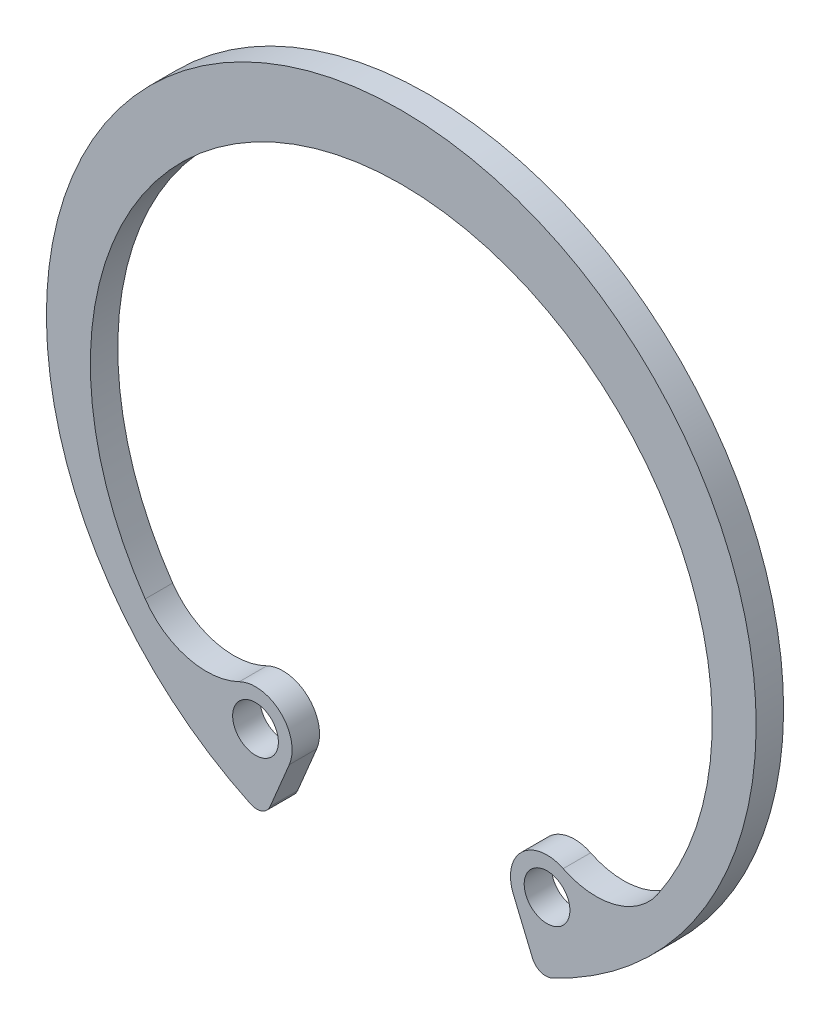
from build123d import *

# Parameters (mm, degrees)
BOSS_EXTRUDE1_DEPTH      = 0.75
BOSS_EXTRUDE1_DEPTH_BACK = 0.75
SKETCH3_R                = 1.25
FILLET1_R                = 0.79375


with BuildPart() as part:
    # Sketch3 → Boss-Extrude1 (new, two sides: drawn at the far end of the back side and taken through both)
    with BuildSketch(Plane.XY.offset(-BOSS_EXTRUDE1_DEPTH_BACK)):
        with BuildLine():
            Line((-6.123024463, -14.646111137), (-7.482857143, -17.898794624))
            ThreePointArc((-7.482857143, -17.898794624), (0, 19.4), (7.482857143, -17.898794624))
            Line((7.482857143, -17.898794624), (6.123024463, -14.646111137))
            ThreePointArc((6.123024463, -14.646111137), (6.598115307, -12.417733451), (8.851442376, -12.080249313))
            ThreePointArc((8.851442376, -12.080249313), (11.675553045, -12.366684891), (13.999758002, -10.737047592))
            ThreePointArc((13.999758002, -10.737047592), (0, 15.9), (-13.999758002, -10.737047592))
            ThreePointArc((-13.999758002, -10.737047592), (-11.675553045, -12.366684891), (-8.851442376, -12.080249313))
            ThreePointArc((-8.851442376, -12.080249313), (-6.598115307, -12.417733451), (-6.123024463, -14.646111137))
        make_face()
        with Locations((-7.968261022, -13.874682565)):
            Circle(SKETCH3_R, mode=Mode.SUBTRACT)
        with Locations(Location((7.968261022, -13.874682565, 0), (0, 0, 180))):
            Circle(SKETCH3_R, mode=Mode.SUBTRACT)
    extrude(amount=BOSS_EXTRUDE1_DEPTH + BOSS_EXTRUDE1_DEPTH_BACK)

    # Fillet1
    fillet1_edges = [part.edges().sort_by_distance(p)[0] for p in [
        (7.482857143, -17.898794624, 0),
        (-7.482857143, -17.898794624, 0),
    ]]
    fillet(fillet1_edges, radius=FILLET1_R)


solid = part.part
